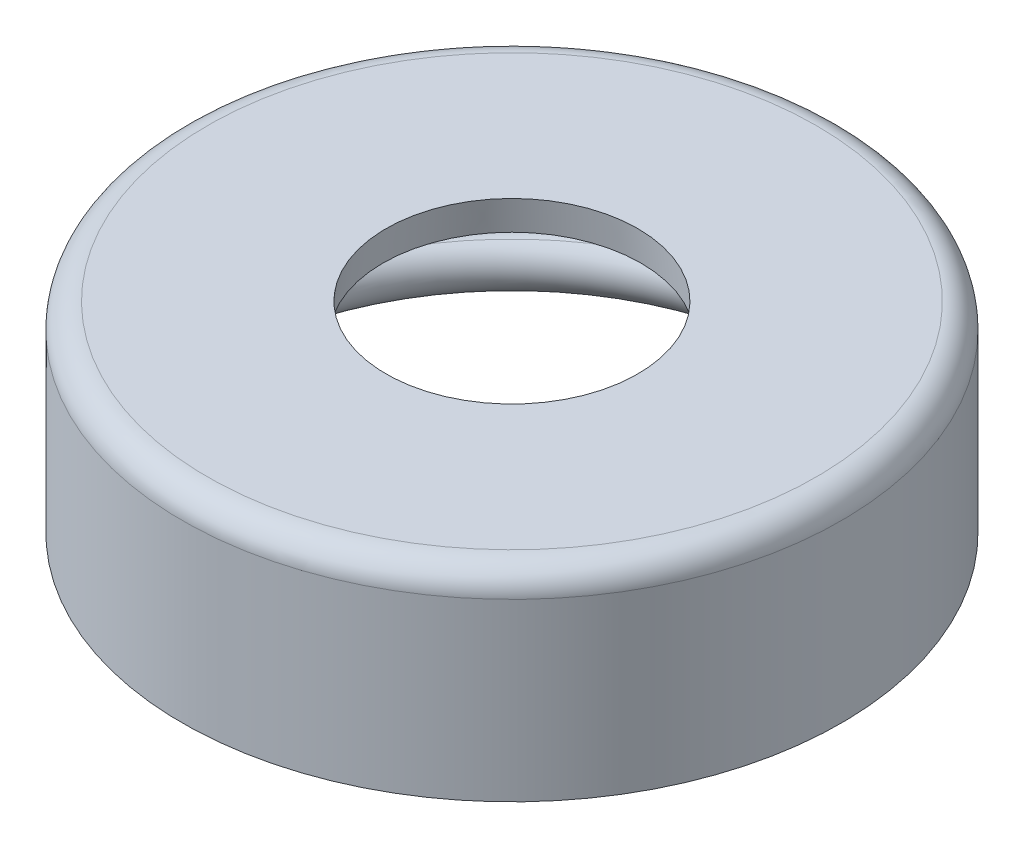
from build123d import *


with BuildPart() as part:
    # Sketch1 → Revolve1 (revolve)
    with BuildSketch(Plane.XY, mode=Mode.PRIVATE) as revolve1_sk:
        with BuildLine():
            Line((12.0269, 0.508129433), (12.0269, 4.990057463))
            Line((12.0269, 4.990057463), (5.207, 4.990057463))
            Line((5.207, 4.990057463), (5.08, 6.260057463))
            Line((5.08, 6.260057463), (12.2809, 6.260057463))
            ThreePointArc((12.2809, 6.260057463), (12.99932049, 5.962477952), (13.2969, 5.244057463))
            Line((13.2969, 5.244057463), (13.2969, -1.829842537))
            Line((13.2969, -1.829842537), (12.0269, -1.829842537))
            ThreePointArc((12.0269, -1.829842537), (11.330182262, -0.940102098), (11.802382058, 0.086582375))
            ThreePointArc((11.802382058, 0.086582375), (11.967270876, 0.269325), (12.0269, 0.508129433))
        make_face()
    revolve(revolve1_sk.sketch.rotate(Axis((0, 0, 0), (0, 1, 0)), 90), axis=Axis((0, 0, 0), (0, 1, 0)))


solid = part.part
